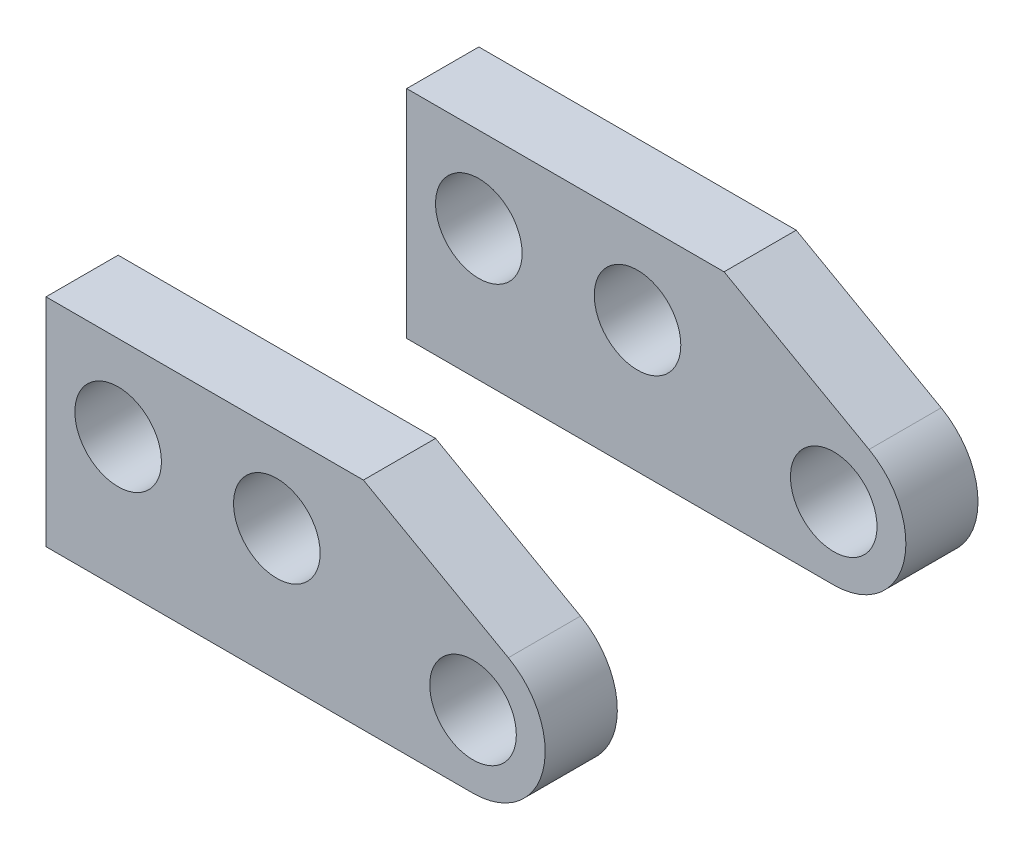
from build123d import *

# Parameters (mm, degrees)
SKETCH_2_R      = 1.5
EXTRUDE_1_DEPTH = 2.5
EXTRUDE_START   = 10
SKETCH_3_R      = 1.5
EXTRUDE_2_DEPTH = 2.5


with BuildPart() as part:
    # 草图2 → 凸台-拉伸1 (new body)
    with BuildSketch(Plane.XY):
        with BuildLine():
            Line((5.5, 3.75), (10.523718398, 0.930025982))
            ThreePointArc((10.523718398, 0.930025982), (11.718684038, -1.882429856), (9.3, -3.75))
            Line((9.3, -3.75), (5.5, -3.75))
            Line((5.5, -3.75), (-5.5, -3.75))
            Line((-5.5, -3.75), (-5.5, 3.75))
            Line((-5.5, 3.75), (5.5, 3.75))
        make_face()
        with Locations((9.3, -1.25)):
            Circle(SKETCH_2_R, mode=Mode.SUBTRACT)
        with Locations((-3, 0.8)):
            Circle(SKETCH_2_R, mode=Mode.SUBTRACT)
        with Locations((2.5, 0.8)):
            Circle(SKETCH_2_R, mode=Mode.SUBTRACT)
    extrude(amount=EXTRUDE_1_DEPTH)


with BuildPart() as body_2:
    # 草图3 → 凸台-拉伸2 (new body)
    with BuildSketch(Plane.XY.offset(2.5).offset(EXTRUDE_START)):
        with BuildLine():
            Line((-5.5, -3.75), (9.3, -3.75))
            ThreePointArc((9.3, -3.75), (11.718684038, -1.882429856), (10.523718398, 0.930025982))
            Line((10.523718398, 0.930025982), (5.5, 3.75))
            Line((5.5, 3.75), (-5.5, 3.75))
            Line((-5.5, 3.75), (-5.5, -3.75))
        make_face()
        with Locations((9.3, -1.25)):
            Circle(SKETCH_3_R, mode=Mode.SUBTRACT)
        with Locations((2.5, 0.8)):
            Circle(SKETCH_3_R, mode=Mode.SUBTRACT)
        with Locations((-3, 0.8)):
            Circle(SKETCH_3_R, mode=Mode.SUBTRACT)
    extrude(amount=EXTRUDE_2_DEPTH)


solid = Compound([part.part, body_2.part])
